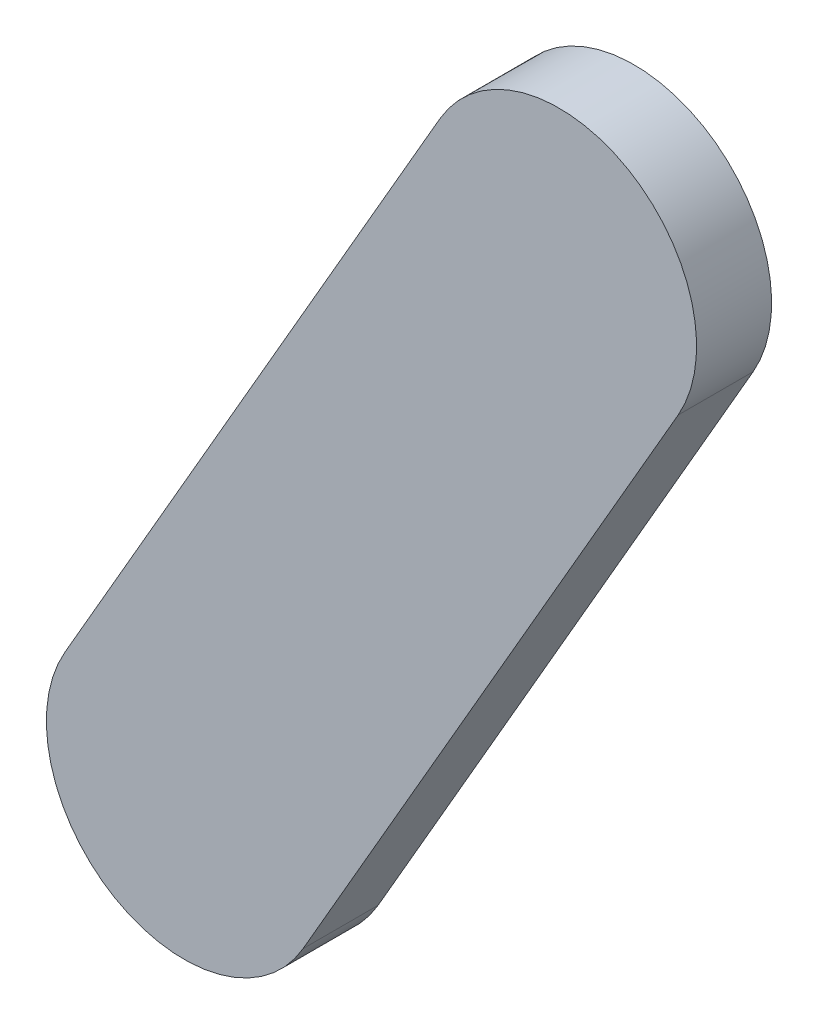
from build123d import *

# Parameters (mm, degrees)
BOSS_EXTRUDE1_DEPTH = 1.5


with BuildPart() as part:
    # Sketch1 → Boss-Extrude1 (new, symmetric)
    with BuildSketch(Plane.XY):
        with BuildLine():
            Line((-4.763139721, 2.75), (10.236860279, 28.730762114))
            ThreePointArc((10.236860279, 28.730762114), (17.75, 30.743901834), (19.763139721, 23.230762114))
            Line((19.763139721, 23.230762114), (4.763139721, -2.75))
            ThreePointArc((4.763139721, -2.75), (-2.75, -4.763139721), (-4.763139721, 2.75))
        make_face()
    extrude(amount=BOSS_EXTRUDE1_DEPTH, both=True)


solid = part.part
